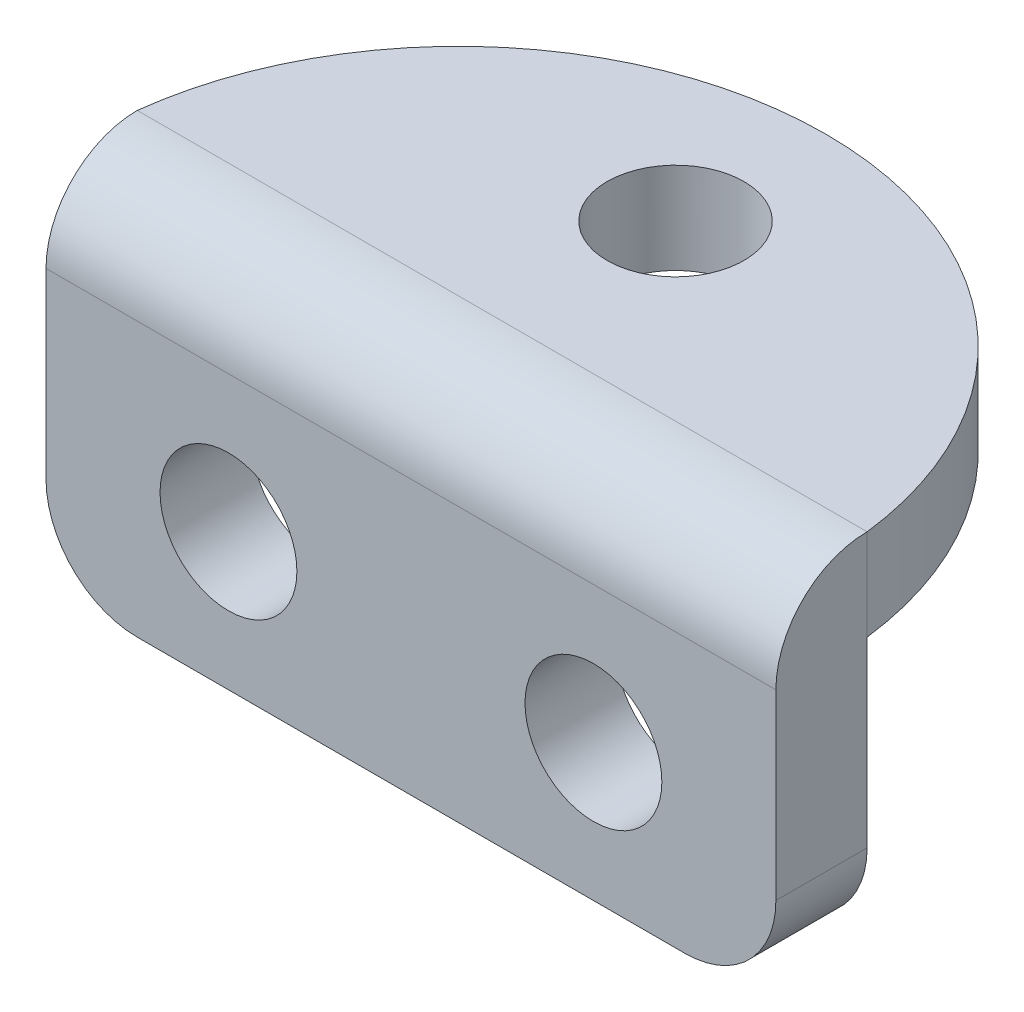
from build123d import *

# Parameters (mm, degrees)
BOSS_EXTRUDE1_DEPTH     = 2
BOSS_EXTRUDE2_DEPTH     = 2
SKETCH10_R              = 1.5
CORTAR_EXTRUIR1_DEPTH   = 10
CROQUIS1_R              = 1.5
CORTAR_EXTRUIR2_DEPTH   = 10
SALIENTE_EXTRUIR1_DEPTH = 16


with BuildPart() as part:
    # Sketch1 → Boss-Extrude1 (new body)
    with BuildSketch(Plane.XY):
        with BuildLine():
            Line((0, 0), (0, -4))
            ThreePointArc((0, -4), (0.585786438, -5.414213562), (2, -6))
            Line((2, -6), (14, -6))
            ThreePointArc((14, -6), (15.414213562, -5.414213562), (16, -4))
            Line((16, -4), (16, 0))
            Line((16, 0), (0, 0))
        make_face()
    extrude(amount=BOSS_EXTRUDE1_DEPTH)

    # Sketch10 → Cortar-Extruir1 (cut)
    with BuildSketch(Plane(origin=(0, 0, 0), x_dir=(-1, 0, 0), z_dir=(0, 0, -1))):
        with Locations((-12, -3)):
            Circle(SKETCH10_R)
        with Locations((-4, -3)):
            Circle(SKETCH10_R)
    extrude(amount=-CORTAR_EXTRUIR1_DEPTH, mode=Mode.SUBTRACT)



with BuildPart() as body_2:
    # Sketch5 → Boss-Extrude2 (new body)
    with BuildSketch(Plane(origin=(0, 0, 0), x_dir=(1, 0, 0), z_dir=(0, 1, 0))):
        with BuildLine():
            Line((0, 0), (16, 0))
            ThreePointArc((16, 0), (8, 7.097527245), (0, 0))
        make_face()
    extrude(amount=BOSS_EXTRUDE2_DEPTH)

    # Croquis1 → Cortar-Extruir2 (cut)
    with BuildSketch(Plane(origin=(0, 2, 0), x_dir=(1, 0, 0), z_dir=(0, 1, 0))):
        with Locations(Location((8, 3.8, 0), (0, 0, 180))):
            Circle(CROQUIS1_R)
    extrude(amount=-CORTAR_EXTRUIR2_DEPTH, mode=Mode.SUBTRACT)


with BuildPart() as part_1:
    add(part.part)

    add(body_2.part)  # Saliente-Extruir1 merges body 2
    # Croquis2 → Saliente-Extruir1 (add)
    with BuildSketch(Plane.ZY):
        with BuildLine():
            Line((2, 0), (0, 0))
            Line((0, 0), (0, 2))
            ThreePointArc((0, 2), (1.414213562, 1.414213562), (2, 0))
        make_face()
    extrude(amount=-SALIENTE_EXTRUIR1_DEPTH)


solid = part_1.part
